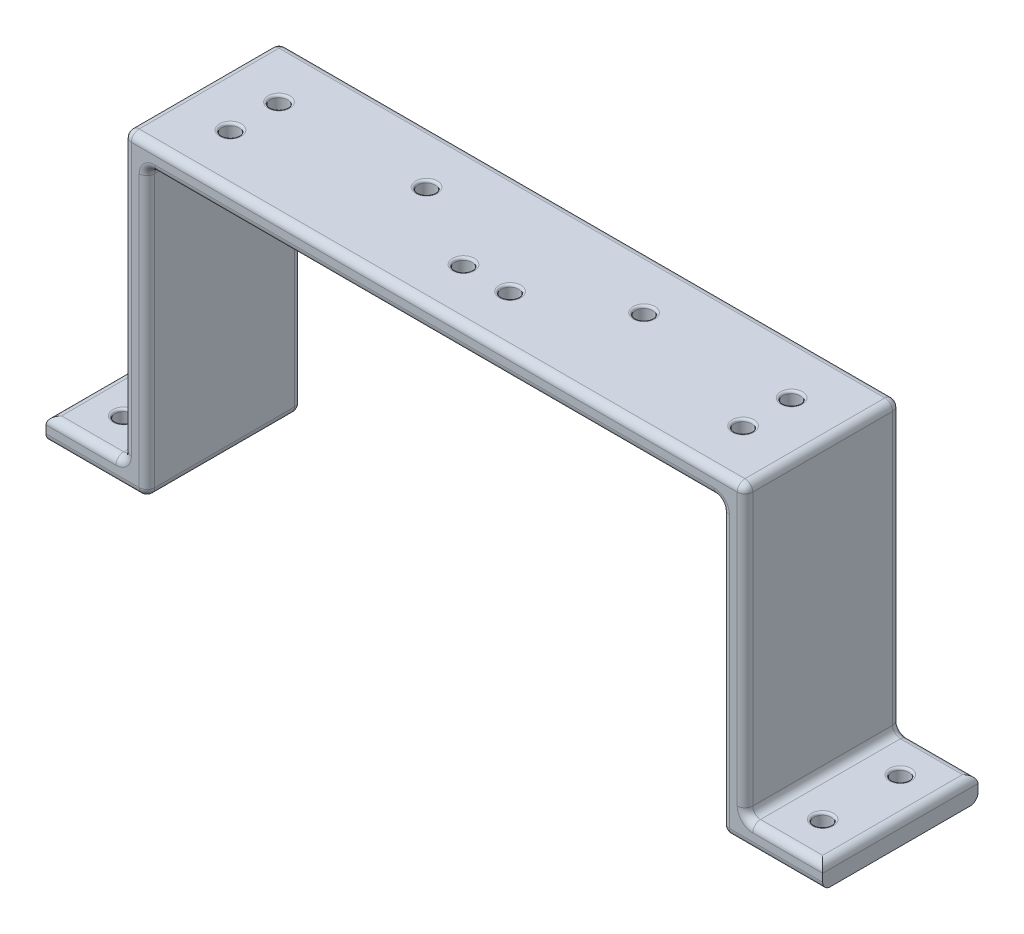
from build123d import *

# Parameters (mm, degrees)
SKETCH_1_W                 = 10
SKETCH_1_H                 = 20
EXTRUDE_1_DEPTH            = 3
F_2_2_2_2_DIAMETER_HOLE2_D = 2.2
SKETCH_5_W                 = 20
SKETCH_5_H                 = 40
EXTRUDE_2_DEPTH            = 80
CUT_EXTRUDE_1_REACH        = 107
SKETCH_6_W                 = 74
SKETCH_6_H                 = 37
F_2_2_2_2_DIAMETER_HOLE3_D = 2.2
FILLET_1_R                 = 1
FILLET_2_R                 = 0.3


with BuildPart() as part:
    # 草图1 → 凸台-拉伸1 (new body)
    with BuildSketch(Plane(origin=(0, 0, 0), x_dir=(1, 0, 0), z_dir=(0, 1, 0))):
        Rectangle(SKETCH_1_W, SKETCH_1_H)
    extrude_1 = extrude(amount=EXTRUDE_1_DEPTH)

    # Ø2.2 (2.2) Diameter Hole2 (through all)
    with Locations(Plane(origin=(0, 3, 0), x_dir=(1, 0, 0), z_dir=(0, 1, 0))):
        with Locations((0, 5), (0, -5)):
            f_2_2_2_2_diameter_hole2 = Hole(F_2_2_2_2_DIAMETER_HOLE2_D / 2)

    # 草图5 → 凸台-拉伸2 (add)
    with BuildSketch(Plane(origin=(5, 0, 0), x_dir=(0, 0, -1), z_dir=(1, 0, 0))):
        with Locations((0, 20)):
            Rectangle(SKETCH_5_W, SKETCH_5_H)
    extrude(amount=EXTRUDE_2_DEPTH)

    # 镜向1: 凸台-拉伸1, Ø2.2 (2.2) Diameter Hole2 across plane
    add(extrude_1.mirror(Plane.ZY.offset(-45)))
    add(f_2_2_2_2_diameter_hole2.mirror(Plane.ZY.offset(-45)), mode=Mode.SUBTRACT)

    # 草图6 → 切除-拉伸1 (cut, up to next)
    with BuildSketch(Plane.XY.offset(10), mode=Mode.PRIVATE) as cut_extrude_1_sk1:
        with Locations((45, 18.5)):
            Rectangle(SKETCH_6_W, SKETCH_6_H)
    cut_extrude_1_tool1 = extrude(cut_extrude_1_sk1.sketch, amount=-CUT_EXTRUDE_1_REACH, mode=Mode.PRIVATE) & part.part
    add(cut_extrude_1_tool1.solids().sort_by_distance((45, 18.5, 10))[0], mode=Mode.SUBTRACT)

    # Ø2.2 (2.2) Diameter Hole3 (through all)
    with Locations(Plane(origin=(0, 40, 0), x_dir=(1, 0, 0), z_dir=(0, 1, 0))):
        with Locations((12, -3.25), (78, -3.25), (48, -3.25), (42, -3.25), (78, 3), (12, 3), (31, 3), (59, 3)):
            Hole(F_2_2_2_2_DIAMETER_HOLE3_D / 2)

    # 圆角1
    fillet_1_edges = [part.edges().sort_by_distance(p)[0] for p in [
        (5, 3, 0),
        (0, 3, -10),
        (5, 21.5, 10),
        (45, 40, 10),
        (5, 21.5, -10),
        (5, 40, 0),
        (45, 40, -10),
        (85, 21.5, 10),
        (85, 40, 0),
        (85, 21.5, -10),
        (95, 3, 0),
        (90, 3, -10),
        (85, 3, 0),
        (90, 3, 10),
        (-5, 3, 0),
        (88.5, 0, -10),
        (1.5, 0, 10),
        (1.5, 0, -10),
        (88.5, 0, 10),
        (8, 0, 0),
        (8, 37, 0),
        (82, 37, 0),
        (82, 0, 0),
        (8, 18.5, 10),
        (82, 18.5, 10),
        (45, 37, 10),
        (8, 18.5, -10),
        (45, 37, -10),
        (82, 18.5, -10),
        (0, 3, 10),
    ]]
    fillet(fillet_1_edges, radius=FILLET_1_R)

    # 圆角2
    fillet_2_edges = [part.edges().sort_by_distance(p)[0] for p in [
        (13.1, 40, -3),
        (13.1, 37, -3),
        (79.1, 40, -3),
        (79.1, 37, -3),
        (43.1, 40, 3.25),
        (43.1, 37, 3.25),
        (49.1, 40, 3.25),
        (49.1, 37, 3.25),
        (79.1, 40, 3.25),
        (79.1, 37, 3.25),
        (13.1, 40, 3.25),
        (13.1, 37, 3.25),
        (1.1, 3, 5),
        (1.1, 0, 5),
        (1.1, 3, -5),
        (1.1, 0, -5),
        (88.9, 3, 5),
        (88.9, 0, 5),
        (88.9, 3, -5),
        (88.9, 0, -5),
        (60.1, 40, -3),
        (60.1, 37, -3),
        (32.1, 40, -3),
        (32.1, 37, -3),
    ]]
    fillet(fillet_2_edges, radius=FILLET_2_R)


solid = part.part
